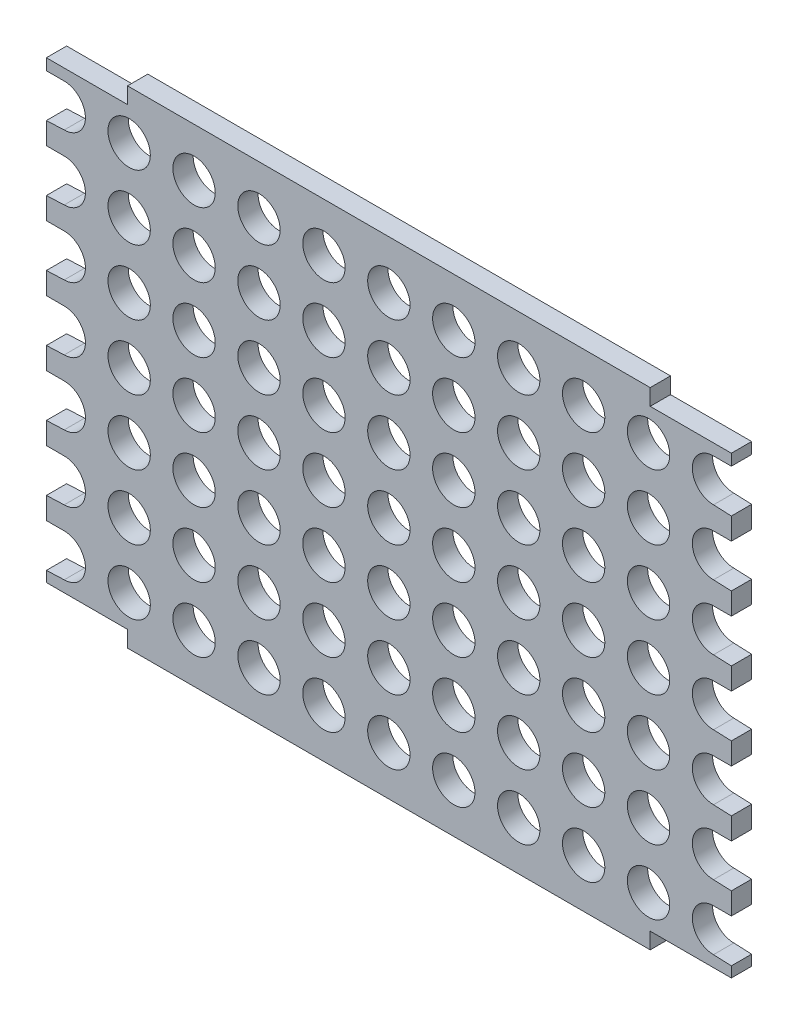
from build123d import *

# Parameters (mm, degrees)
SKETCH1_W            = 107.188
SKETCH1_H            = 76.2
EXTRUDE1_DEPTH       = 3.175
SKETCH7_W            = 12.7
SKETCH7_H            = 2.54
EXTRUDE2_DEPTH       = 66.833179029
LPATTERN1_COUNT      = 6
LPATTERN1_PITCH      = 10.16
LPATTERN1_COL_COUNT  = 6
LPATTERN1_COL_PITCH  = 10.16
LPATTERN2_COUNT      = 4
LPATTERN2_PITCH      = 10.16
LPATTERN2_COL_COUNT  = 4
LPATTERN2_COL_PITCH  = 10.16
EXTRUDE3_DEPTH       = 66.833179029
LPATTERN3_COUNT      = 7
LPATTERN3_PITCH      = 10.16
MIRROR2_COPY_1_DEPTH = 66.833179029
MIRROR2_COPY_2_DEPTH = 66.833179029
MIRROR2_COPY_3_DEPTH = 66.833179029
MIRROR2_COPY_4_DEPTH = 66.833179029
MIRROR2_COPY_5_DEPTH = 66.833179029
MIRROR2_COPY_6_DEPTH = 66.833179029


with BuildPart() as part:
    # Sketch1 → Extrude1 (new body)
    with BuildSketch(Plane.XY):
        Rectangle(SKETCH1_W, SKETCH1_H)
    extrude(amount=EXTRUDE1_DEPTH)

    # Sketch7 → Extrude2 (cut, through all)
    with BuildSketch(Plane.XY.offset(3.175)):
        with Locations((-47.244, 36.83)):
            Rectangle(SKETCH7_W, SKETCH7_H)
        with Locations((-47.244, -36.83)):
            Rectangle(SKETCH7_W, SKETCH7_H)
    extrude2 = extrude(amount=-EXTRUDE2_DEPTH, mode=Mode.SUBTRACT)

    # Mirror1: Extrude2 across plane
    add(extrude2.mirror(Plane(origin=(0, 0, 0), x_dir=(0, 0, 1), z_dir=(1, 0, 0))), mode=Mode.SUBTRACT)

    # Sketch5 → G (0.261) Diameter Hole1 (revolve, cut)
    with BuildSketch(Plane(origin=(0, 0, 3.175), x_dir=(0, -1, 0), z_dir=(1, 0, 0))):
        Polygon((0, 0), (0, 17.231672694), (3.3147, 15.24), (3.3147, 0), align=None)
    g_0_261_diameter_hole1 = revolve(axis=Axis((0, 0, 9.525), (0, 0, -1)), mode=Mode.SUBTRACT)

    # LPattern1: G (0.261) Diameter Hole1 ×6
    with Locations(*[(i * LPATTERN1_PITCH, 0, 0) for i in range(1, LPATTERN1_COUNT)]):
        add(g_0_261_diameter_hole1, mode=Mode.SUBTRACT)

    # LPattern1 col: G (0.261) Diameter Hole1 ×6
    with Locations(*[(-i * LPATTERN1_COL_PITCH, 0, 0) for i in range(1, LPATTERN1_COL_COUNT)]):
        add(g_0_261_diameter_hole1, mode=Mode.SUBTRACT)

    # LPattern2: G (0.261) Diameter Hole1 ×4
    with Locations(*[(0, -i * LPATTERN2_PITCH, 0) for i in range(1, LPATTERN2_COUNT)]):
        add(g_0_261_diameter_hole1, mode=Mode.SUBTRACT)

    # LPattern2 copy 1 sketch → LPattern2 copy 1 (revolve, cut)
    with BuildSketch(Plane(origin=(10.16, -10.16, 3.175), x_dir=(0, -1, 0), z_dir=(1, 0, 0))):
        Polygon((0, 0), (0, 17.231672694), (3.3147, 15.24), (3.3147, 0), align=None)
    revolve(axis=Axis((10.16, -10.16, 9.525), (0, 0, -1)), mode=Mode.SUBTRACT)

    # LPattern2 copy 2 sketch → LPattern2 copy 2 (revolve, cut)
    with BuildSketch(Plane(origin=(10.16, -20.32, 3.175), x_dir=(0, -1, 0), z_dir=(1, 0, 0))):
        Polygon((0, 0), (0, 17.231672694), (3.3147, 15.24), (3.3147, 0), align=None)
    revolve(axis=Axis((10.16, -20.32, 9.525), (0, 0, -1)), mode=Mode.SUBTRACT)

    # LPattern2 copy 3 sketch → LPattern2 copy 3 (revolve, cut)
    with BuildSketch(Plane(origin=(10.16, -30.48, 3.175), x_dir=(0, -1, 0), z_dir=(1, 0, 0))):
        Polygon((0, 0), (0, 17.231672694), (3.3147, 15.24), (3.3147, 0), align=None)
    revolve(axis=Axis((10.16, -30.48, 9.525), (0, 0, -1)), mode=Mode.SUBTRACT)

    # LPattern2 copy 4 sketch → LPattern2 copy 4 (revolve, cut)
    with BuildSketch(Plane(origin=(20.32, -10.16, 3.175), x_dir=(0, -1, 0), z_dir=(1, 0, 0))):
        Polygon((0, 0), (0, 17.231672694), (3.3147, 15.24), (3.3147, 0), align=None)
    revolve(axis=Axis((20.32, -10.16, 9.525), (0, 0, -1)), mode=Mode.SUBTRACT)

    # LPattern2 copy 5 sketch → LPattern2 copy 5 (revolve, cut)
    with BuildSketch(Plane(origin=(20.32, -20.32, 3.175), x_dir=(0, -1, 0), z_dir=(1, 0, 0))):
        Polygon((0, 0), (0, 17.231672694), (3.3147, 15.24), (3.3147, 0), align=None)
    revolve(axis=Axis((20.32, -20.32, 9.525), (0, 0, -1)), mode=Mode.SUBTRACT)

    # LPattern2 copy 6 sketch → LPattern2 copy 6 (revolve, cut)
    with BuildSketch(Plane(origin=(20.32, -30.48, 3.175), x_dir=(0, -1, 0), z_dir=(1, 0, 0))):
        Polygon((0, 0), (0, 17.231672694), (3.3147, 15.24), (3.3147, 0), align=None)
    revolve(axis=Axis((20.32, -30.48, 9.525), (0, 0, -1)), mode=Mode.SUBTRACT)

    # LPattern2 copy 7 sketch → LPattern2 copy 7 (revolve, cut)
    with BuildSketch(Plane(origin=(30.48, -10.16, 3.175), x_dir=(0, -1, 0), z_dir=(1, 0, 0))):
        Polygon((0, 0), (0, 17.231672694), (3.3147, 15.24), (3.3147, 0), align=None)
    revolve(axis=Axis((30.48, -10.16, 9.525), (0, 0, -1)), mode=Mode.SUBTRACT)

    # LPattern2 copy 8 sketch → LPattern2 copy 8 (revolve, cut)
    with BuildSketch(Plane(origin=(30.48, -20.32, 3.175), x_dir=(0, -1, 0), z_dir=(1, 0, 0))):
        Polygon((0, 0), (0, 17.231672694), (3.3147, 15.24), (3.3147, 0), align=None)
    revolve(axis=Axis((30.48, -20.32, 9.525), (0, 0, -1)), mode=Mode.SUBTRACT)

    # LPattern2 copy 9 sketch → LPattern2 copy 9 (revolve, cut)
    with BuildSketch(Plane(origin=(30.48, -30.48, 3.175), x_dir=(0, -1, 0), z_dir=(1, 0, 0))):
        Polygon((0, 0), (0, 17.231672694), (3.3147, 15.24), (3.3147, 0), align=None)
    revolve(axis=Axis((30.48, -30.48, 9.525), (0, 0, -1)), mode=Mode.SUBTRACT)

    # LPattern2 copy 10 sketch → LPattern2 copy 10 (revolve, cut)
    with BuildSketch(Plane(origin=(40.64, -10.16, 3.175), x_dir=(0, -1, 0), z_dir=(1, 0, 0))):
        Polygon((0, 0), (0, 17.231672694), (3.3147, 15.24), (3.3147, 0), align=None)
    revolve(axis=Axis((40.64, -10.16, 9.525), (0, 0, -1)), mode=Mode.SUBTRACT)

    # LPattern2 copy 11 sketch → LPattern2 copy 11 (revolve, cut)
    with BuildSketch(Plane(origin=(40.64, -20.32, 3.175), x_dir=(0, -1, 0), z_dir=(1, 0, 0))):
        Polygon((0, 0), (0, 17.231672694), (3.3147, 15.24), (3.3147, 0), align=None)
    revolve(axis=Axis((40.64, -20.32, 9.525), (0, 0, -1)), mode=Mode.SUBTRACT)

    # LPattern2 copy 12 sketch → LPattern2 copy 12 (revolve, cut)
    with BuildSketch(Plane(origin=(40.64, -30.48, 3.175), x_dir=(0, -1, 0), z_dir=(1, 0, 0))):
        Polygon((0, 0), (0, 17.231672694), (3.3147, 15.24), (3.3147, 0), align=None)
    revolve(axis=Axis((40.64, -30.48, 9.525), (0, 0, -1)), mode=Mode.SUBTRACT)

    # LPattern2 copy 13 sketch → LPattern2 copy 13 (revolve, cut)
    with BuildSketch(Plane(origin=(50.8, -10.16, 3.175), x_dir=(0, -1, 0), z_dir=(1, 0, 0))):
        Polygon((0, 0), (0, 17.231672694), (3.3147, 15.24), (3.3147, 0), align=None)
    revolve(axis=Axis((50.8, -10.16, 9.525), (0, 0, -1)), mode=Mode.SUBTRACT)

    # LPattern2 copy 14 sketch → LPattern2 copy 14 (revolve, cut)
    with BuildSketch(Plane(origin=(50.8, -20.32, 3.175), x_dir=(0, -1, 0), z_dir=(1, 0, 0))):
        Polygon((0, 0), (0, 17.231672694), (3.3147, 15.24), (3.3147, 0), align=None)
    revolve(axis=Axis((50.8, -20.32, 9.525), (0, 0, -1)), mode=Mode.SUBTRACT)

    # LPattern2 copy 15 sketch → LPattern2 copy 15 (revolve, cut)
    with BuildSketch(Plane(origin=(50.8, -30.48, 3.175), x_dir=(0, -1, 0), z_dir=(1, 0, 0))):
        Polygon((0, 0), (0, 17.231672694), (3.3147, 15.24), (3.3147, 0), align=None)
    revolve(axis=Axis((50.8, -30.48, 9.525), (0, 0, -1)), mode=Mode.SUBTRACT)

    # LPattern2 copy 16 sketch → LPattern2 copy 16 (revolve, cut)
    with BuildSketch(Plane(origin=(-10.16, -10.16, 3.175), x_dir=(0, -1, 0), z_dir=(1, 0, 0))):
        Polygon((0, 0), (0, 17.231672694), (3.3147, 15.24), (3.3147, 0), align=None)
    revolve(axis=Axis((-10.16, -10.16, 9.525), (0, 0, -1)), mode=Mode.SUBTRACT)

    # LPattern2 copy 17 sketch → LPattern2 copy 17 (revolve, cut)
    with BuildSketch(Plane(origin=(-10.16, -20.32, 3.175), x_dir=(0, -1, 0), z_dir=(1, 0, 0))):
        Polygon((0, 0), (0, 17.231672694), (3.3147, 15.24), (3.3147, 0), align=None)
    revolve(axis=Axis((-10.16, -20.32, 9.525), (0, 0, -1)), mode=Mode.SUBTRACT)

    # LPattern2 copy 18 sketch → LPattern2 copy 18 (revolve, cut)
    with BuildSketch(Plane(origin=(-10.16, -30.48, 3.175), x_dir=(0, -1, 0), z_dir=(1, 0, 0))):
        Polygon((0, 0), (0, 17.231672694), (3.3147, 15.24), (3.3147, 0), align=None)
    revolve(axis=Axis((-10.16, -30.48, 9.525), (0, 0, -1)), mode=Mode.SUBTRACT)

    # LPattern2 copy 19 sketch → LPattern2 copy 19 (revolve, cut)
    with BuildSketch(Plane(origin=(-20.32, -10.16, 3.175), x_dir=(0, -1, 0), z_dir=(1, 0, 0))):
        Polygon((0, 0), (0, 17.231672694), (3.3147, 15.24), (3.3147, 0), align=None)
    revolve(axis=Axis((-20.32, -10.16, 9.525), (0, 0, -1)), mode=Mode.SUBTRACT)

    # LPattern2 copy 20 sketch → LPattern2 copy 20 (revolve, cut)
    with BuildSketch(Plane(origin=(-20.32, -20.32, 3.175), x_dir=(0, -1, 0), z_dir=(1, 0, 0))):
        Polygon((0, 0), (0, 17.231672694), (3.3147, 15.24), (3.3147, 0), align=None)
    revolve(axis=Axis((-20.32, -20.32, 9.525), (0, 0, -1)), mode=Mode.SUBTRACT)

    # LPattern2 copy 21 sketch → LPattern2 copy 21 (revolve, cut)
    with BuildSketch(Plane(origin=(-20.32, -30.48, 3.175), x_dir=(0, -1, 0), z_dir=(1, 0, 0))):
        Polygon((0, 0), (0, 17.231672694), (3.3147, 15.24), (3.3147, 0), align=None)
    revolve(axis=Axis((-20.32, -30.48, 9.525), (0, 0, -1)), mode=Mode.SUBTRACT)

    # LPattern2 copy 22 sketch → LPattern2 copy 22 (revolve, cut)
    with BuildSketch(Plane(origin=(-30.48, -10.16, 3.175), x_dir=(0, -1, 0), z_dir=(1, 0, 0))):
        Polygon((0, 0), (0, 17.231672694), (3.3147, 15.24), (3.3147, 0), align=None)
    revolve(axis=Axis((-30.48, -10.16, 9.525), (0, 0, -1)), mode=Mode.SUBTRACT)

    # LPattern2 copy 23 sketch → LPattern2 copy 23 (revolve, cut)
    with BuildSketch(Plane(origin=(-30.48, -20.32, 3.175), x_dir=(0, -1, 0), z_dir=(1, 0, 0))):
        Polygon((0, 0), (0, 17.231672694), (3.3147, 15.24), (3.3147, 0), align=None)
    revolve(axis=Axis((-30.48, -20.32, 9.525), (0, 0, -1)), mode=Mode.SUBTRACT)

    # LPattern2 copy 24 sketch → LPattern2 copy 24 (revolve, cut)
    with BuildSketch(Plane(origin=(-30.48, -30.48, 3.175), x_dir=(0, -1, 0), z_dir=(1, 0, 0))):
        Polygon((0, 0), (0, 17.231672694), (3.3147, 15.24), (3.3147, 0), align=None)
    revolve(axis=Axis((-30.48, -30.48, 9.525), (0, 0, -1)), mode=Mode.SUBTRACT)

    # LPattern2 copy 25 sketch → LPattern2 copy 25 (revolve, cut)
    with BuildSketch(Plane(origin=(-40.64, -10.16, 3.175), x_dir=(0, -1, 0), z_dir=(1, 0, 0))):
        Polygon((0, 0), (0, 17.231672694), (3.3147, 15.24), (3.3147, 0), align=None)
    revolve(axis=Axis((-40.64, -10.16, 9.525), (0, 0, -1)), mode=Mode.SUBTRACT)

    # LPattern2 copy 26 sketch → LPattern2 copy 26 (revolve, cut)
    with BuildSketch(Plane(origin=(-40.64, -20.32, 3.175), x_dir=(0, -1, 0), z_dir=(1, 0, 0))):
        Polygon((0, 0), (0, 17.231672694), (3.3147, 15.24), (3.3147, 0), align=None)
    revolve(axis=Axis((-40.64, -20.32, 9.525), (0, 0, -1)), mode=Mode.SUBTRACT)

    # LPattern2 copy 27 sketch → LPattern2 copy 27 (revolve, cut)
    with BuildSketch(Plane(origin=(-40.64, -30.48, 3.175), x_dir=(0, -1, 0), z_dir=(1, 0, 0))):
        Polygon((0, 0), (0, 17.231672694), (3.3147, 15.24), (3.3147, 0), align=None)
    revolve(axis=Axis((-40.64, -30.48, 9.525), (0, 0, -1)), mode=Mode.SUBTRACT)

    # LPattern2 copy 28 sketch → LPattern2 copy 28 (revolve, cut)
    with BuildSketch(Plane(origin=(-50.8, -10.16, 3.175), x_dir=(0, -1, 0), z_dir=(1, 0, 0))):
        Polygon((0, 0), (0, 17.231672694), (3.3147, 15.24), (3.3147, 0), align=None)
    revolve(axis=Axis((-50.8, -10.16, 9.525), (0, 0, -1)), mode=Mode.SUBTRACT)

    # LPattern2 copy 29 sketch → LPattern2 copy 29 (revolve, cut)
    with BuildSketch(Plane(origin=(-50.8, -20.32, 3.175), x_dir=(0, -1, 0), z_dir=(1, 0, 0))):
        Polygon((0, 0), (0, 17.231672694), (3.3147, 15.24), (3.3147, 0), align=None)
    revolve(axis=Axis((-50.8, -20.32, 9.525), (0, 0, -1)), mode=Mode.SUBTRACT)

    # LPattern2 copy 30 sketch → LPattern2 copy 30 (revolve, cut)
    with BuildSketch(Plane(origin=(-50.8, -30.48, 3.175), x_dir=(0, -1, 0), z_dir=(1, 0, 0))):
        Polygon((0, 0), (0, 17.231672694), (3.3147, 15.24), (3.3147, 0), align=None)
    revolve(axis=Axis((-50.8, -30.48, 9.525), (0, 0, -1)), mode=Mode.SUBTRACT)

    # LPattern2 col: G (0.261) Diameter Hole1 ×4
    with Locations(*[(0, i * LPATTERN2_COL_PITCH, 0) for i in range(1, LPATTERN2_COL_COUNT)]):
        add(g_0_261_diameter_hole1, mode=Mode.SUBTRACT)

    # LPattern2 col copy 1 sketch → LPattern2 col copy 1 (revolve, cut)
    with BuildSketch(Plane(origin=(10.16, 10.16, 3.175), x_dir=(0, -1, 0), z_dir=(1, 0, 0))):
        Polygon((0, 0), (0, 17.231672694), (3.3147, 15.24), (3.3147, 0), align=None)
    revolve(axis=Axis((10.16, 10.16, 9.525), (0, 0, -1)), mode=Mode.SUBTRACT)

    # LPattern2 col copy 2 sketch → LPattern2 col copy 2 (revolve, cut)
    with BuildSketch(Plane(origin=(10.16, 20.32, 3.175), x_dir=(0, -1, 0), z_dir=(1, 0, 0))):
        Polygon((0, 0), (0, 17.231672694), (3.3147, 15.24), (3.3147, 0), align=None)
    revolve(axis=Axis((10.16, 20.32, 9.525), (0, 0, -1)), mode=Mode.SUBTRACT)

    # LPattern2 col copy 3 sketch → LPattern2 col copy 3 (revolve, cut)
    with BuildSketch(Plane(origin=(10.16, 30.48, 3.175), x_dir=(0, -1, 0), z_dir=(1, 0, 0))):
        Polygon((0, 0), (0, 17.231672694), (3.3147, 15.24), (3.3147, 0), align=None)
    revolve(axis=Axis((10.16, 30.48, 9.525), (0, 0, -1)), mode=Mode.SUBTRACT)

    # LPattern2 col copy 4 sketch → LPattern2 col copy 4 (revolve, cut)
    with BuildSketch(Plane(origin=(20.32, 10.16, 3.175), x_dir=(0, -1, 0), z_dir=(1, 0, 0))):
        Polygon((0, 0), (0, 17.231672694), (3.3147, 15.24), (3.3147, 0), align=None)
    revolve(axis=Axis((20.32, 10.16, 9.525), (0, 0, -1)), mode=Mode.SUBTRACT)

    # LPattern2 col copy 5 sketch → LPattern2 col copy 5 (revolve, cut)
    with BuildSketch(Plane(origin=(20.32, 20.32, 3.175), x_dir=(0, -1, 0), z_dir=(1, 0, 0))):
        Polygon((0, 0), (0, 17.231672694), (3.3147, 15.24), (3.3147, 0), align=None)
    revolve(axis=Axis((20.32, 20.32, 9.525), (0, 0, -1)), mode=Mode.SUBTRACT)

    # LPattern2 col copy 6 sketch → LPattern2 col copy 6 (revolve, cut)
    with BuildSketch(Plane(origin=(20.32, 30.48, 3.175), x_dir=(0, -1, 0), z_dir=(1, 0, 0))):
        Polygon((0, 0), (0, 17.231672694), (3.3147, 15.24), (3.3147, 0), align=None)
    revolve(axis=Axis((20.32, 30.48, 9.525), (0, 0, -1)), mode=Mode.SUBTRACT)

    # LPattern2 col copy 7 sketch → LPattern2 col copy 7 (revolve, cut)
    with BuildSketch(Plane(origin=(30.48, 10.16, 3.175), x_dir=(0, -1, 0), z_dir=(1, 0, 0))):
        Polygon((0, 0), (0, 17.231672694), (3.3147, 15.24), (3.3147, 0), align=None)
    revolve(axis=Axis((30.48, 10.16, 9.525), (0, 0, -1)), mode=Mode.SUBTRACT)

    # LPattern2 col copy 8 sketch → LPattern2 col copy 8 (revolve, cut)
    with BuildSketch(Plane(origin=(30.48, 20.32, 3.175), x_dir=(0, -1, 0), z_dir=(1, 0, 0))):
        Polygon((0, 0), (0, 17.231672694), (3.3147, 15.24), (3.3147, 0), align=None)
    revolve(axis=Axis((30.48, 20.32, 9.525), (0, 0, -1)), mode=Mode.SUBTRACT)

    # LPattern2 col copy 9 sketch → LPattern2 col copy 9 (revolve, cut)
    with BuildSketch(Plane(origin=(30.48, 30.48, 3.175), x_dir=(0, -1, 0), z_dir=(1, 0, 0))):
        Polygon((0, 0), (0, 17.231672694), (3.3147, 15.24), (3.3147, 0), align=None)
    revolve(axis=Axis((30.48, 30.48, 9.525), (0, 0, -1)), mode=Mode.SUBTRACT)

    # LPattern2 col copy 10 sketch → LPattern2 col copy 10 (revolve, cut)
    with BuildSketch(Plane(origin=(40.64, 10.16, 3.175), x_dir=(0, -1, 0), z_dir=(1, 0, 0))):
        Polygon((0, 0), (0, 17.231672694), (3.3147, 15.24), (3.3147, 0), align=None)
    revolve(axis=Axis((40.64, 10.16, 9.525), (0, 0, -1)), mode=Mode.SUBTRACT)

    # LPattern2 col copy 11 sketch → LPattern2 col copy 11 (revolve, cut)
    with BuildSketch(Plane(origin=(40.64, 20.32, 3.175), x_dir=(0, -1, 0), z_dir=(1, 0, 0))):
        Polygon((0, 0), (0, 17.231672694), (3.3147, 15.24), (3.3147, 0), align=None)
    revolve(axis=Axis((40.64, 20.32, 9.525), (0, 0, -1)), mode=Mode.SUBTRACT)

    # LPattern2 col copy 12 sketch → LPattern2 col copy 12 (revolve, cut)
    with BuildSketch(Plane(origin=(40.64, 30.48, 3.175), x_dir=(0, -1, 0), z_dir=(1, 0, 0))):
        Polygon((0, 0), (0, 17.231672694), (3.3147, 15.24), (3.3147, 0), align=None)
    revolve(axis=Axis((40.64, 30.48, 9.525), (0, 0, -1)), mode=Mode.SUBTRACT)

    # LPattern2 col copy 13 sketch → LPattern2 col copy 13 (revolve, cut)
    with BuildSketch(Plane(origin=(50.8, 10.16, 3.175), x_dir=(0, -1, 0), z_dir=(1, 0, 0))):
        Polygon((0, 0), (0, 17.231672694), (3.3147, 15.24), (3.3147, 0), align=None)
    revolve(axis=Axis((50.8, 10.16, 9.525), (0, 0, -1)), mode=Mode.SUBTRACT)

    # LPattern2 col copy 14 sketch → LPattern2 col copy 14 (revolve, cut)
    with BuildSketch(Plane(origin=(50.8, 20.32, 3.175), x_dir=(0, -1, 0), z_dir=(1, 0, 0))):
        Polygon((0, 0), (0, 17.231672694), (3.3147, 15.24), (3.3147, 0), align=None)
    revolve(axis=Axis((50.8, 20.32, 9.525), (0, 0, -1)), mode=Mode.SUBTRACT)

    # LPattern2 col copy 15 sketch → LPattern2 col copy 15 (revolve, cut)
    with BuildSketch(Plane(origin=(50.8, 30.48, 3.175), x_dir=(0, -1, 0), z_dir=(1, 0, 0))):
        Polygon((0, 0), (0, 17.231672694), (3.3147, 15.24), (3.3147, 0), align=None)
    revolve(axis=Axis((50.8, 30.48, 9.525), (0, 0, -1)), mode=Mode.SUBTRACT)

    # LPattern2 col copy 16 sketch → LPattern2 col copy 16 (revolve, cut)
    with BuildSketch(Plane(origin=(-10.16, 10.16, 3.175), x_dir=(0, -1, 0), z_dir=(1, 0, 0))):
        Polygon((0, 0), (0, 17.231672694), (3.3147, 15.24), (3.3147, 0), align=None)
    revolve(axis=Axis((-10.16, 10.16, 9.525), (0, 0, -1)), mode=Mode.SUBTRACT)

    # LPattern2 col copy 17 sketch → LPattern2 col copy 17 (revolve, cut)
    with BuildSketch(Plane(origin=(-10.16, 20.32, 3.175), x_dir=(0, -1, 0), z_dir=(1, 0, 0))):
        Polygon((0, 0), (0, 17.231672694), (3.3147, 15.24), (3.3147, 0), align=None)
    revolve(axis=Axis((-10.16, 20.32, 9.525), (0, 0, -1)), mode=Mode.SUBTRACT)

    # LPattern2 col copy 18 sketch → LPattern2 col copy 18 (revolve, cut)
    with BuildSketch(Plane(origin=(-10.16, 30.48, 3.175), x_dir=(0, -1, 0), z_dir=(1, 0, 0))):
        Polygon((0, 0), (0, 17.231672694), (3.3147, 15.24), (3.3147, 0), align=None)
    revolve(axis=Axis((-10.16, 30.48, 9.525), (0, 0, -1)), mode=Mode.SUBTRACT)

    # LPattern2 col copy 19 sketch → LPattern2 col copy 19 (revolve, cut)
    with BuildSketch(Plane(origin=(-20.32, 10.16, 3.175), x_dir=(0, -1, 0), z_dir=(1, 0, 0))):
        Polygon((0, 0), (0, 17.231672694), (3.3147, 15.24), (3.3147, 0), align=None)
    revolve(axis=Axis((-20.32, 10.16, 9.525), (0, 0, -1)), mode=Mode.SUBTRACT)

    # LPattern2 col copy 20 sketch → LPattern2 col copy 20 (revolve, cut)
    with BuildSketch(Plane(origin=(-20.32, 20.32, 3.175), x_dir=(0, -1, 0), z_dir=(1, 0, 0))):
        Polygon((0, 0), (0, 17.231672694), (3.3147, 15.24), (3.3147, 0), align=None)
    revolve(axis=Axis((-20.32, 20.32, 9.525), (0, 0, -1)), mode=Mode.SUBTRACT)

    # LPattern2 col copy 21 sketch → LPattern2 col copy 21 (revolve, cut)
    with BuildSketch(Plane(origin=(-20.32, 30.48, 3.175), x_dir=(0, -1, 0), z_dir=(1, 0, 0))):
        Polygon((0, 0), (0, 17.231672694), (3.3147, 15.24), (3.3147, 0), align=None)
    revolve(axis=Axis((-20.32, 30.48, 9.525), (0, 0, -1)), mode=Mode.SUBTRACT)

    # LPattern2 col copy 22 sketch → LPattern2 col copy 22 (revolve, cut)
    with BuildSketch(Plane(origin=(-30.48, 10.16, 3.175), x_dir=(0, -1, 0), z_dir=(1, 0, 0))):
        Polygon((0, 0), (0, 17.231672694), (3.3147, 15.24), (3.3147, 0), align=None)
    revolve(axis=Axis((-30.48, 10.16, 9.525), (0, 0, -1)), mode=Mode.SUBTRACT)

    # LPattern2 col copy 23 sketch → LPattern2 col copy 23 (revolve, cut)
    with BuildSketch(Plane(origin=(-30.48, 20.32, 3.175), x_dir=(0, -1, 0), z_dir=(1, 0, 0))):
        Polygon((0, 0), (0, 17.231672694), (3.3147, 15.24), (3.3147, 0), align=None)
    revolve(axis=Axis((-30.48, 20.32, 9.525), (0, 0, -1)), mode=Mode.SUBTRACT)

    # LPattern2 col copy 24 sketch → LPattern2 col copy 24 (revolve, cut)
    with BuildSketch(Plane(origin=(-30.48, 30.48, 3.175), x_dir=(0, -1, 0), z_dir=(1, 0, 0))):
        Polygon((0, 0), (0, 17.231672694), (3.3147, 15.24), (3.3147, 0), align=None)
    revolve(axis=Axis((-30.48, 30.48, 9.525), (0, 0, -1)), mode=Mode.SUBTRACT)

    # LPattern2 col copy 25 sketch → LPattern2 col copy 25 (revolve, cut)
    with BuildSketch(Plane(origin=(-40.64, 10.16, 3.175), x_dir=(0, -1, 0), z_dir=(1, 0, 0))):
        Polygon((0, 0), (0, 17.231672694), (3.3147, 15.24), (3.3147, 0), align=None)
    revolve(axis=Axis((-40.64, 10.16, 9.525), (0, 0, -1)), mode=Mode.SUBTRACT)

    # LPattern2 col copy 26 sketch → LPattern2 col copy 26 (revolve, cut)
    with BuildSketch(Plane(origin=(-40.64, 20.32, 3.175), x_dir=(0, -1, 0), z_dir=(1, 0, 0))):
        Polygon((0, 0), (0, 17.231672694), (3.3147, 15.24), (3.3147, 0), align=None)
    revolve(axis=Axis((-40.64, 20.32, 9.525), (0, 0, -1)), mode=Mode.SUBTRACT)

    # LPattern2 col copy 27 sketch → LPattern2 col copy 27 (revolve, cut)
    with BuildSketch(Plane(origin=(-40.64, 30.48, 3.175), x_dir=(0, -1, 0), z_dir=(1, 0, 0))):
        Polygon((0, 0), (0, 17.231672694), (3.3147, 15.24), (3.3147, 0), align=None)
    revolve(axis=Axis((-40.64, 30.48, 9.525), (0, 0, -1)), mode=Mode.SUBTRACT)

    # LPattern2 col copy 28 sketch → LPattern2 col copy 28 (revolve, cut)
    with BuildSketch(Plane(origin=(-50.8, 10.16, 3.175), x_dir=(0, -1, 0), z_dir=(1, 0, 0))):
        Polygon((0, 0), (0, 17.231672694), (3.3147, 15.24), (3.3147, 0), align=None)
    revolve(axis=Axis((-50.8, 10.16, 9.525), (0, 0, -1)), mode=Mode.SUBTRACT)

    # LPattern2 col copy 29 sketch → LPattern2 col copy 29 (revolve, cut)
    with BuildSketch(Plane(origin=(-50.8, 20.32, 3.175), x_dir=(0, -1, 0), z_dir=(1, 0, 0))):
        Polygon((0, 0), (0, 17.231672694), (3.3147, 15.24), (3.3147, 0), align=None)
    revolve(axis=Axis((-50.8, 20.32, 9.525), (0, 0, -1)), mode=Mode.SUBTRACT)

    # LPattern2 col copy 30 sketch → LPattern2 col copy 30 (revolve, cut)
    with BuildSketch(Plane(origin=(-50.8, 30.48, 3.175), x_dir=(0, -1, 0), z_dir=(1, 0, 0))):
        Polygon((0, 0), (0, 17.231672694), (3.3147, 15.24), (3.3147, 0), align=None)
    revolve(axis=Axis((-50.8, 30.48, 9.525), (0, 0, -1)), mode=Mode.SUBTRACT)

    # Sketch8 → Extrude3 (cut, through all)
    with BuildSketch(Plane.XY.offset(3.175)):
        Polygon((-50.8, -27.1653), (-50.8, -33.7947), (-53.594, -33.911739885), (-53.594, -27.1653), align=None)
    extrude3 = extrude(amount=-EXTRUDE3_DEPTH, mode=Mode.SUBTRACT)

    # LPattern3: Extrude3 ×7
    with Locations(*[(0, i * LPATTERN3_PITCH, 0) for i in range(1, LPATTERN3_COUNT)]):
        add(extrude3, mode=Mode.SUBTRACT)

    # Mirror2: Extrude3 across plane
    add(extrude3.mirror(Plane(origin=(0, 0, 0), x_dir=(0, 0, 1), z_dir=(1, 0, 0))), mode=Mode.SUBTRACT)

    # Mirror2 copy 1 sketch → Mirror2 copy 1 (cut, through all)
    with BuildSketch(Plane(origin=(0, 10.16, 3.175), x_dir=(-1, 0, 0), z_dir=(0, 0, 1))):
        Polygon((-50.8, 27.1653), (-50.8, 33.7947), (-53.594, 33.911739885), (-53.594, 27.1653), align=None)
    extrude(amount=-MIRROR2_COPY_1_DEPTH, mode=Mode.SUBTRACT)

    # Mirror2 copy 2 sketch → Mirror2 copy 2 (cut, through all)
    with BuildSketch(Plane(origin=(0, 20.32, 3.175), x_dir=(-1, 0, 0), z_dir=(0, 0, 1))):
        Polygon((-50.8, 27.1653), (-50.8, 33.7947), (-53.594, 33.911739885), (-53.594, 27.1653), align=None)
    extrude(amount=-MIRROR2_COPY_2_DEPTH, mode=Mode.SUBTRACT)

    # Mirror2 copy 3 sketch → Mirror2 copy 3 (cut, through all)
    with BuildSketch(Plane(origin=(0, 30.48, 3.175), x_dir=(-1, 0, 0), z_dir=(0, 0, 1))):
        Polygon((-50.8, 27.1653), (-50.8, 33.7947), (-53.594, 33.911739885), (-53.594, 27.1653), align=None)
    extrude(amount=-MIRROR2_COPY_3_DEPTH, mode=Mode.SUBTRACT)

    # Mirror2 copy 4 sketch → Mirror2 copy 4 (cut, through all)
    with BuildSketch(Plane(origin=(0, 40.64, 3.175), x_dir=(-1, 0, 0), z_dir=(0, 0, 1))):
        Polygon((-50.8, 27.1653), (-50.8, 33.7947), (-53.594, 33.911739885), (-53.594, 27.1653), align=None)
    extrude(amount=-MIRROR2_COPY_4_DEPTH, mode=Mode.SUBTRACT)

    # Mirror2 copy 5 sketch → Mirror2 copy 5 (cut, through all)
    with BuildSketch(Plane(origin=(0, 50.8, 3.175), x_dir=(-1, 0, 0), z_dir=(0, 0, 1))):
        Polygon((-50.8, 27.1653), (-50.8, 33.7947), (-53.594, 33.911739885), (-53.594, 27.1653), align=None)
    extrude(amount=-MIRROR2_COPY_5_DEPTH, mode=Mode.SUBTRACT)

    # Mirror2 copy 6 sketch → Mirror2 copy 6 (cut, through all)
    with BuildSketch(Plane(origin=(0, 60.96, 3.175), x_dir=(-1, 0, 0), z_dir=(0, 0, 1))):
        Polygon((-50.8, 27.1653), (-50.8, 33.7947), (-53.594, 33.911739885), (-53.594, 27.1653), align=None)
    extrude(amount=-MIRROR2_COPY_6_DEPTH, mode=Mode.SUBTRACT)


solid = part.part
